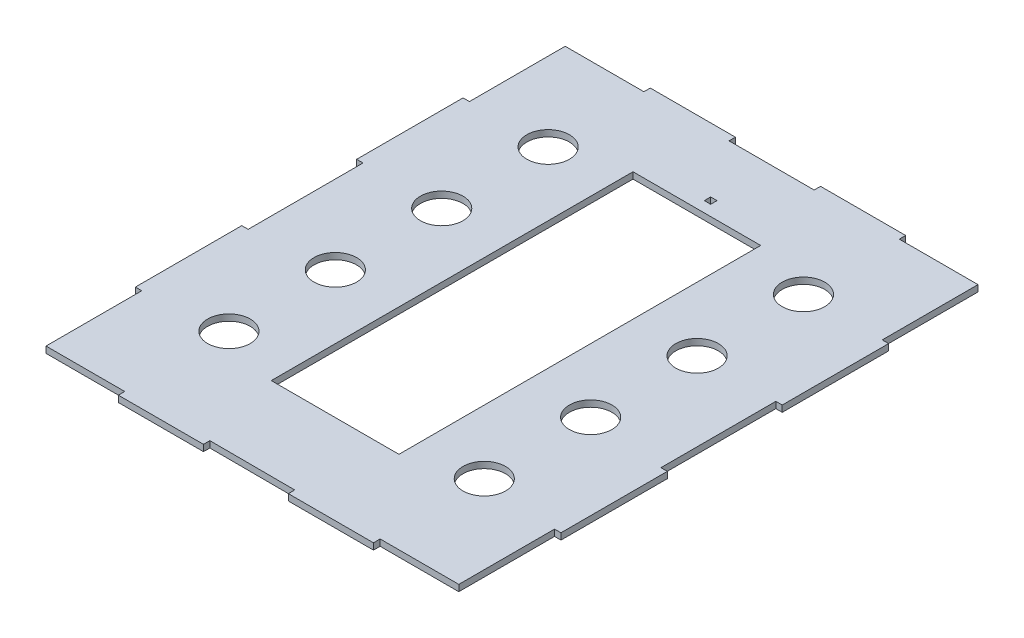
from build123d import *

# Parameters (mm, degrees)
BOSS_EXTRUDE1_DEPTH = 3
SKETCH2_R           = 10
SKETCH2_W           = 60
SKETCH2_H           = 170
CUT_EXTRUDE1_DEPTH  = 162.672508486


with BuildPart() as part:
    # Sketch1 → Boss-Extrude1 (new body)
    with BuildSketch(Plane(origin=(0, 0, 0), x_dir=(1, 0, 0), z_dir=(0, 1, 0))):
        Polygon((20, 123.132735738), (60, 123.132735738), (60, 120.132735738), (97, 120.132735738), (97, 75.132735738), (100, 75.132735738), (100, 25.132735738), (97, 25.132735738), (97, -28.867264262), (100, -28.867264262), (100, -78.867264262), (97, -78.867264262), (97, -123.867264262), (60.028527915, -123.867264262), (60.028527915, -127), (20.028527915, -127), (20.028527915, -124), (-19.971472085, -123.867399906), (-20, -126.867264262), (-60, -126.867264262), (-60.028027258, -123.867395186), (-97, -123.867264262), (-97, -78.867264262), (-100, -78.867264262), (-100, -28.867264262), (-97, -28.867264262), (-97, 25.132735738), (-100, 25.132735738), (-100, 75.132735738), (-97, 75.132735738), (-97, 120.132735738), (-60, 120.132735738), (-60, 123.132735738), (-20, 123.132735738), (-20, 120.132735738), (20, 120.132735738), align=None)
    extrude(amount=BOSS_EXTRUDE1_DEPTH)

    # Sketch2 → Cut-Extrude1 (cut, through all)
    with BuildSketch(Plane(origin=(0, 3, 0), x_dir=(1, 0, 0), z_dir=(0, 1, 0))):
        with Locations(Location((-60.028027258, 75.132735738, 0), (0, 0, 270))):
            Circle(SKETCH2_R)
        with Locations(Location((59.971972742, 75.132735738, 0), (0, 0, 270))):
            Circle(SKETCH2_R)
        with Locations(Location((-60.028027258, 25.132735738, 0), (0, 0, 270))):
            Circle(SKETCH2_R)
        with Locations(Location((59.971972742, 25.132735738, 0), (0, 0, 270))):
            Circle(SKETCH2_R)
        with Locations(Location((-60.028027258, -24.867264262, 0), (0, 0, 270))):
            Circle(SKETCH2_R)
        with Locations(Location((59.971972742, -24.867264262, 0), (0, 0, 270))):
            Circle(SKETCH2_R)
        with Locations(Location((-60.028027258, -74.867264262, 0), (0, 0, 270))):
            Circle(SKETCH2_R)
        with Locations(Location((59.971972742, -74.867264262, 0), (0, 0, 270))):
            Circle(SKETCH2_R)
        Rectangle(SKETCH2_W, SKETCH2_H)
        Polygon((0, 90), (-1.5, 90), (-1.5, 93), (1.5, 93), (1.5, 90), align=None)
    extrude(amount=-CUT_EXTRUDE1_DEPTH, mode=Mode.SUBTRACT)


solid = part.part
